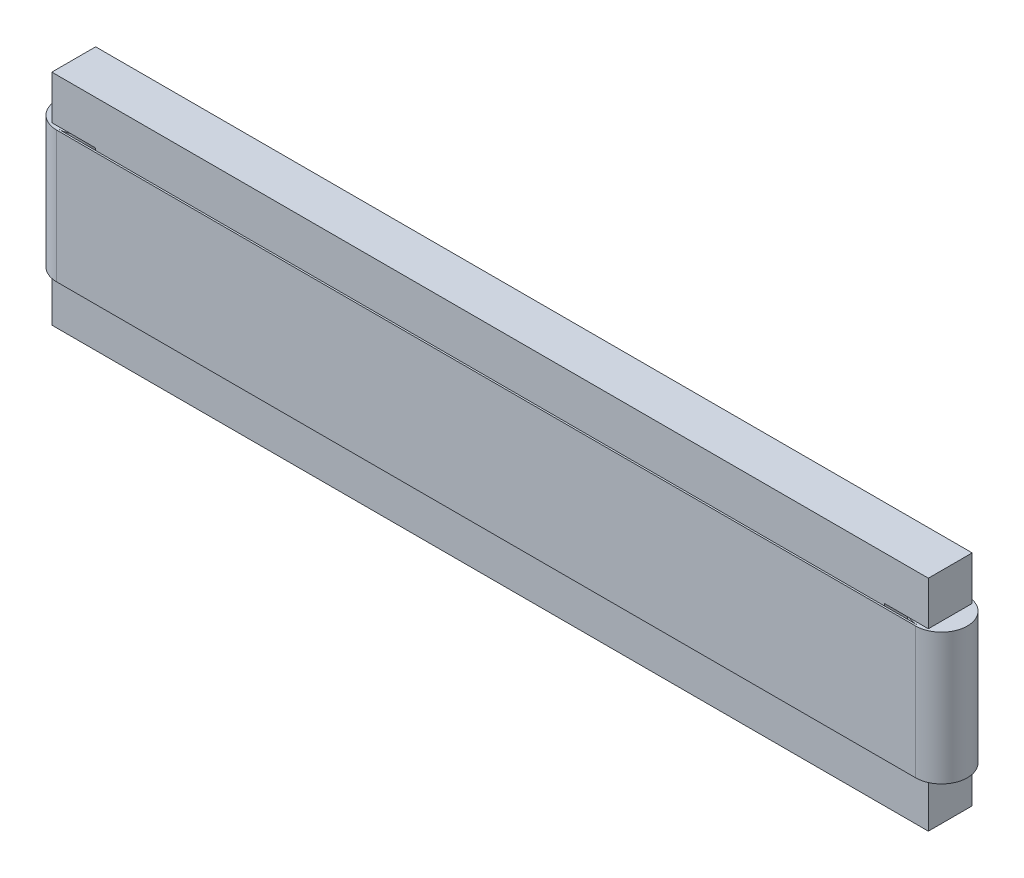
from build123d import *

# Parameters (mm, degrees)
BOSS_EXTRUDE2_DEPTH = 50
SKETCH2_R           = 27.5
BOSS_EXTRUDE3_DEPTH = 150
BOSS_EXTRUDE4_START = -150
BOSS_EXTRUDE4_DEPTH = 150


with BuildPart() as part:
    # Sketch1 → Boss-Extrude2 (new body)
    with BuildSketch(Plane.XY):
        Polygon((-500, 250), (500, 250), (500, 200), (450, 200), (450, 50), (500, 50), (500, 0), (-500, 0), (-500, 50), (-450, 50), (-450, 200), (-500, 200), align=None)
    extrude(amount=BOSS_EXTRUDE2_DEPTH)

    # Sketch2 → Boss-Extrude3 (add)
    with BuildSketch(Plane.XZ.offset(-200)):
        with Locations(Location((-490, 25, 0), (0, 0, 65.380022671))):
            Circle(SKETCH2_R)
    boss_extrude3 = extrude(amount=BOSS_EXTRUDE3_DEPTH)

    # Mirror1: Boss-Extrude3 across plane
    add(boss_extrude3.mirror(Plane(origin=(0, 0, 0), x_dir=(0, 0, 1), z_dir=(1, 0, 0))))

    # Sketch3 → Boss-Extrude4 (add)
    with BuildSketch(Plane.XZ.offset(-50).offset(BOSS_EXTRUDE4_START)):
        with BuildLine():
            Line((-490, 54.5), (490, 54.5))
            ThreePointArc((490, 54.5), (519.5, 25), (490, -4.5))
            Line((490, -4.5), (-490, -4.5))
            ThreePointArc((-490, -4.5), (-519.5, 25), (-490, 54.5))
        make_face()
        with BuildLine():
            Line((-490, 52.5), (490, 52.5))
            ThreePointArc((490, 52.5), (517.5, 25), (490, -2.5))
            Line((490, -2.5), (-490, -2.5))
            ThreePointArc((-490, -2.5), (-517.5, 25), (-490, 52.5))
        make_face(mode=Mode.SUBTRACT)
    extrude(amount=BOSS_EXTRUDE4_DEPTH)


solid = part.part
